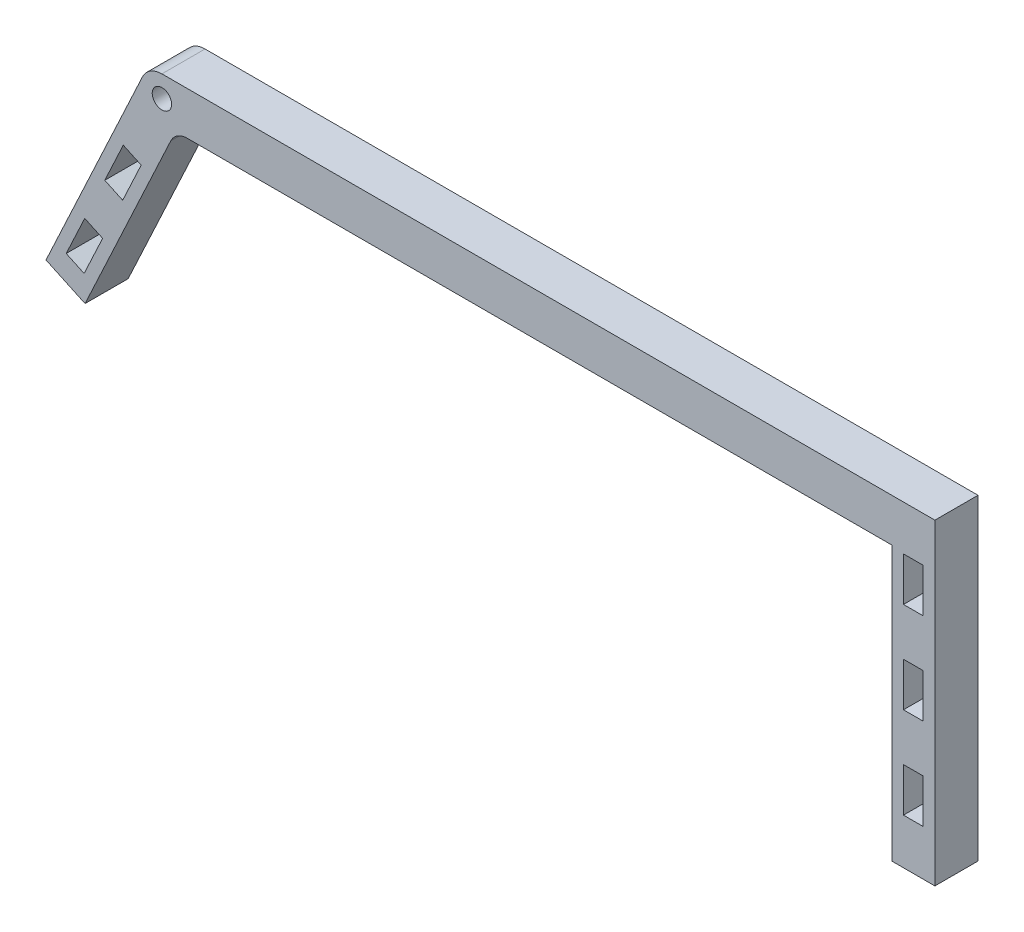
from build123d import *

# Parameters (mm, degrees)
SKETCH1_R           = 1.35
SKETCH1_W           = 6
SKETCH1_H           = 38.1
SKETCH1_H_2         = 6
BOSS_EXTRUDE1_DEPTH = 3
FILLET1_R           = 2.54
CUT_EXTRUDE1_DEPTH  = 81.055232476
LPATTERN1_COUNT     = 2
LPATTERN1_PITCH     = 12.7
SKETCH3_W           = 2.75
SKETCH3_H           = 6.096
CUT_EXTRUDE2_DEPTH  = 81.055232476
LPATTERN2_COUNT     = 3
LPATTERN2_PITCH     = 12.7


with BuildPart() as part:
    # Sketch1 → Boss-Extrude1 (new, symmetric)
    # profile 1 of 3: a face of its own
    with BuildSketch(Plane.XY):
        with BuildLine():
            Line((-62.999206449, -30.043127024), (-50.388789218, -3))
            Line((-50.388789218, -3), (49.3, -3))
            Line((49.3, -3), (49.3, 3))
            Line((49.3, 3), (-52.3, 3))
            ThreePointArc((-52.3, 3), (-53.911898825, 2.530174337), (-55.018923361, 1.267854785))
            Line((-55.018923361, 1.267854785), (-55.3, 0.665083988))
            Line((-55.3, 0.665083988), (-68.437053171, -27.507417453))
            Line((-68.437053171, -27.507417453), (-62.999206449, -30.043127024))
        make_face()
        with Locations((-52.3, 0)):
            Circle(SKETCH1_R, mode=Mode.SUBTRACT)
    # profile 2 of 3: a face of its own
    with BuildSketch(Plane.XY):
        with Locations((52.3, -22.05)):
            Rectangle(SKETCH1_W, SKETCH1_H)
    # profile 3 of 3: a face of its own
    with BuildSketch(Plane.XY):
        with Locations((52.3, 0)):
            Rectangle(SKETCH1_W, SKETCH1_H_2)
    extrude(amount=BOSS_EXTRUDE1_DEPTH, both=True)

    # Fillet1
    fillet1_edges = [part.edges().sort_by_distance(p)[0] for p in [
        (-50.388789218, -3, 0),
    ]]
    fillet(fillet1_edges, radius=FILLET1_R)

    # Sketch2 → Cut-Extrude1 (cut, symmetric)
    with BuildSketch(Plane.XY.offset(3)):
        Polygon((-63.046209113, -19.791792635), (-65.622490036, -25.316644905), (-63.130143622, -26.478845124), (-60.553862698, -20.953992855), align=None)
    cut_extrude1 = extrude(amount=CUT_EXTRUDE1_DEPTH, both=True, mode=Mode.SUBTRACT)

    # LPattern1: Cut-Extrude1 ×2
    with Locations(*[Vector(0.42261826174070405, 0.9063077870366479, 0) * (i * LPATTERN1_PITCH) for i in range(1, LPATTERN1_COUNT)]):
        add(cut_extrude1, mode=Mode.SUBTRACT)

    # Sketch3 → Cut-Extrude2 (cut, symmetric)
    with BuildSketch(Plane.XY.offset(3)):
        with Locations((52.3, -31.702)):
            Rectangle(SKETCH3_W, SKETCH3_H)
    cut_extrude2 = extrude(amount=CUT_EXTRUDE2_DEPTH, both=True, mode=Mode.SUBTRACT)

    # LPattern2: Cut-Extrude2 ×3
    with Locations(*[(0, i * LPATTERN2_PITCH, 0) for i in range(1, LPATTERN2_COUNT)]):
        add(cut_extrude2, mode=Mode.SUBTRACT)


solid = part.part
